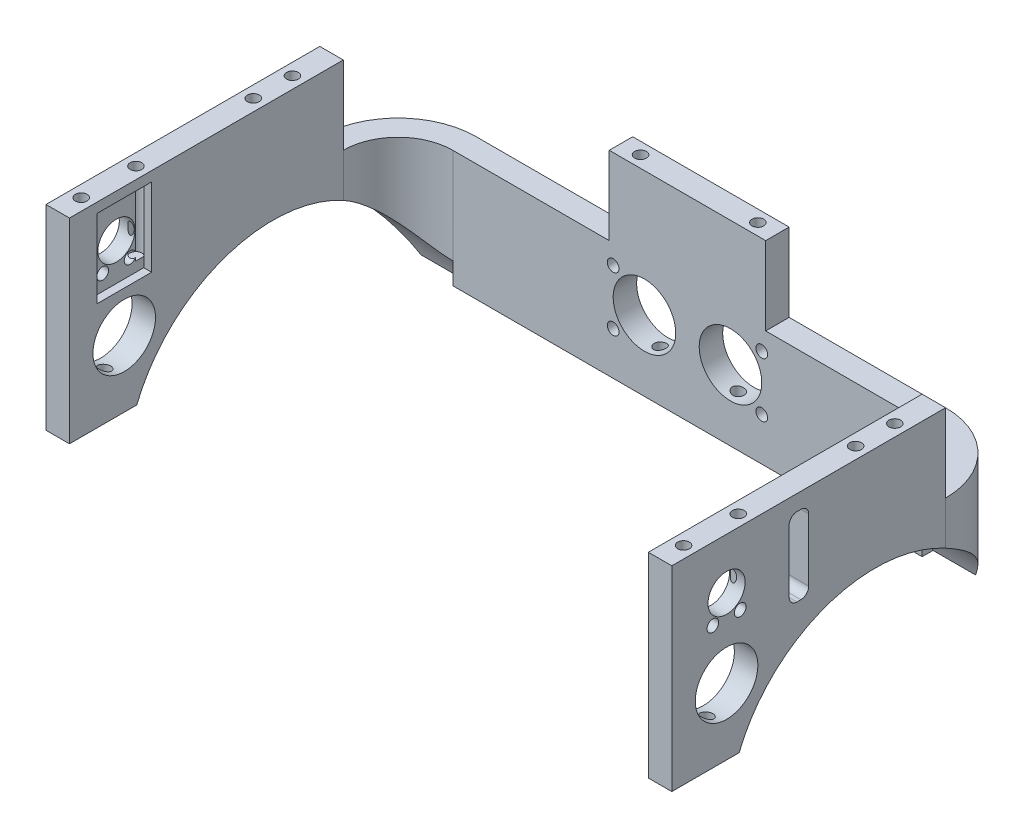
from build123d import *

# Parameters (mm, degrees)
SALIENTE_EXTRUIR1_DEPTH = 50
CROQUIS3_W              = 60
CROQUIS3_H              = 20
CORTAR_EXTRUIR1_DEPTH   = 20
CROQUIS4_R              = 8
CROQUIS4_R_2            = 1.5
CORTAR_EXTRUIR2_DEPTH   = 10
CROQUIS5_R              = 8
CROQUIS5_R_2            = 4.75
CROQUIS5_R_3            = 1.5
CORTAR_EXTRUIR3_DEPTH   = 172
CROQUIS6_W              = 14
CROQUIS6_H              = 20
CROQUIS6_R              = 4.75
CORTAR_EXTRUIR4_DEPTH   = 2
CORTAR_EXTRUIR5_START   = -2
CROQUIS7_W              = 14
CROQUIS7_H              = 20
CROQUIS7_R              = 4.75
CORTAR_EXTRUIR5_DEPTH   = 2
CROQUIS8_R              = 37.5
CORTAR_EXTRUIR6_DEPTH   = 20
CORTAR_EXTRUIR7_START   = -20
CROQUIS9_R              = 37.5
CORTAR_EXTRUIR7_DEPTH   = 20
CROQUIS10_R             = 1.5
CORTAR_EXTRUIR8_DEPTH   = 20
CROQUIS11_R             = 1.5
CORTAR_EXTRUIR9_DEPTH   = 20
CORTAR_EXTRUIR10_DEPTH  = 10


with BuildPart() as part:
    # Croquis1 → Saliente-Extruir1 (new body)
    with BuildSketch(Plane(origin=(0, 0, 0), x_dir=(1, 0, 0), z_dir=(0, 1, 0))):
        with BuildLine():
            Line((-20, -6), (-140, -6))
            ThreePointArc((-140, -6), (-149.899494937, -10.100505063), (-154, -20))
            Line((-154, -20), (-154, -84))
            Line((-154, -84), (-154, -90))
            Line((-154, -90), (-160, -90))
            Line((-160, -90), (-160, -20))
            ThreePointArc((-160, -20), (-154.142135624, -5.857864376), (-140, 0))
            Line((-140, 0), (-20, 0))
            ThreePointArc((-20, 0), (-5.857864376, -5.857864376), (0, -20))
            Line((0, -20), (0, -90))
            Line((0, -90), (-6, -90))
            Line((-6, -90), (-6, -84))
            Line((-6, -84), (-6, -20))
            ThreePointArc((-6, -20), (-10.100505063, -10.100505063), (-20, -6))
        make_face()
    extrude(amount=SALIENTE_EXTRUIR1_DEPTH)

    # Croquis3 → Cortar-Extruir1 (cut)
    with BuildSketch(Plane(origin=(0, 50, 0), x_dir=(1, 0, 0), z_dir=(0, 1, 0))):
        with Locations((-130, -10)):
            Rectangle(CROQUIS3_W, CROQUIS3_H)
        with Locations((-30, -10)):
            Rectangle(CROQUIS3_W, CROQUIS3_H)
    extrude(amount=-CORTAR_EXTRUIR1_DEPTH, mode=Mode.SUBTRACT)

    # Croquis4 → Cortar-Extruir2 (cut)
    with BuildSketch(Plane(origin=(0, 0, 0), x_dir=(-1, 0, 0), z_dir=(0, 0, -1))):
        with Locations((69, 18)):
            Circle(CROQUIS4_R)
        with Locations((91, 18)):
            Circle(CROQUIS4_R)
        with Locations((61, 25)):
            Circle(CROQUIS4_R_2)
        with Locations((99, 25)):
            Circle(CROQUIS4_R_2)
        with Locations((99, 11)):
            Circle(CROQUIS4_R_2)
        with Locations((61, 11)):
            Circle(CROQUIS4_R_2)
    extrude(amount=-CORTAR_EXTRUIR2_DEPTH, mode=Mode.SUBTRACT)

    # Croquis5 → Cortar-Extruir3 (cut)
    with BuildSketch(Plane(origin=(0, 0, 0), x_dir=(0, 0, -1), z_dir=(1, 0, 0))):
        with Locations((-76, 17)):
            Circle(CROQUIS5_R)
        with Locations((-76, 37)):
            Circle(CROQUIS5_R_2)
        with Locations((-72.5, 31.5)):
            Circle(CROQUIS5_R_3)
        with Locations((-79.5, 31.5)):
            Circle(CROQUIS5_R_3)
    extrude(amount=-CORTAR_EXTRUIR3_DEPTH, mode=Mode.SUBTRACT)

    # Croquis6 → Cortar-Extruir4 (cut)
    with BuildSketch(Plane(origin=(-154, 0, 0), x_dir=(0, 0, -1), z_dir=(1, 0, 0))):
        with Locations((-76, 37.5)):
            Rectangle(CROQUIS6_W, CROQUIS6_H)
        with Locations((-76, 37)):
            Circle(CROQUIS6_R, mode=Mode.SUBTRACT)
    extrude(amount=-CORTAR_EXTRUIR4_DEPTH, mode=Mode.SUBTRACT)

    # Croquis7 → Cortar-Extruir5 (cut)
    with BuildSketch(Plane.ZY.offset(6).offset(CORTAR_EXTRUIR5_START)):
        with Locations((76, 37.5)):
            Rectangle(CROQUIS7_W, CROQUIS7_H)
        with Locations(Location((76, 37, 0), (0, 0, 180))):
            Circle(CROQUIS7_R, mode=Mode.SUBTRACT)
    extrude(amount=CORTAR_EXTRUIR5_DEPTH, mode=Mode.SUBTRACT)

    # Croquis8 → Cortar-Extruir6 (cut)
    with BuildSketch(Plane.ZY.offset(160)):
        with Locations((38, -14)):
            Circle(CROQUIS8_R)
    extrude(amount=-CORTAR_EXTRUIR6_DEPTH, mode=Mode.SUBTRACT)

    # Croquis9 → Cortar-Extruir7 (cut)
    with BuildSketch(Plane(origin=(0, 0, 0), x_dir=(0, 0, -1), z_dir=(1, 0, 0)).offset(CORTAR_EXTRUIR7_START)):
        with Locations((-38, -14)):
            Circle(CROQUIS9_R)
    extrude(amount=CORTAR_EXTRUIR7_DEPTH, mode=Mode.SUBTRACT)

    # Croquis10 → Cortar-Extruir8 (cut)
    with BuildSketch(Plane(origin=(0, 0, 0), x_dir=(-1, 0, 0), z_dir=(0, -1, 0))):
        with Locations(Location((90, -3, 0), (0, 0, 90))):
            Circle(CROQUIS10_R)
        with Locations(Location((110, -3, 0), (0, 0, 90))):
            Circle(CROQUIS10_R)
        with Locations(Location((130, -3, 0), (0, 0, 90))):
            Circle(CROQUIS10_R)
        with Locations(Location((70, -3, 0), (0, 0, 90))):
            Circle(CROQUIS10_R)
        with Locations(Location((50, -3, 0), (0, 0, 90))):
            Circle(CROQUIS10_R)
        with Locations(Location((30, -3, 0), (0, 0, 90))):
            Circle(CROQUIS10_R)
        with Locations(Location((157, -86, 0), (0, 0, 90))):
            Circle(CROQUIS10_R)
        with Locations(Location((157, -78, 0), (0, 0, 90))):
            Circle(CROQUIS10_R)
        with Locations(Location((3, -86, 0), (0, 0, 90))):
            Circle(CROQUIS10_R)
        with Locations(Location((3, -78, 0), (0, 0, 90))):
            Circle(CROQUIS10_R)
    extrude(amount=-CORTAR_EXTRUIR8_DEPTH, mode=Mode.SUBTRACT)

    # Croquis11 → Cortar-Extruir9 (cut)
    with BuildSketch(Plane(origin=(0, 50, 0), x_dir=(1, 0, 0), z_dir=(0, 1, 0))):
        with Locations(Location((-157, -84, 0), (0, 0, 270))):
            Circle(CROQUIS11_R)
        with Locations(Location((-157, -70, 0), (0, 0, 270))):
            Circle(CROQUIS11_R)
        with Locations(Location((-157, -40, 0), (0, 0, 270))):
            Circle(CROQUIS11_R)
        with Locations(Location((-157, -30, 0), (0, 0, 270))):
            Circle(CROQUIS11_R)
        with Locations(Location((-3, -30, 0), (0, 0, 270))):
            Circle(CROQUIS11_R)
        with Locations(Location((-3, -40, 0), (0, 0, 270))):
            Circle(CROQUIS11_R)
        with Locations(Location((-3, -70, 0), (0, 0, 270))):
            Circle(CROQUIS11_R)
        with Locations(Location((-3, -84, 0), (0, 0, 270))):
            Circle(CROQUIS11_R)
        with Locations(Location((-95, -3, 0), (0, 0, 270))):
            Circle(CROQUIS11_R)
        with Locations(Location((-65, -3, 0), (0, 0, 270))):
            Circle(CROQUIS11_R)
    extrude(amount=-CORTAR_EXTRUIR9_DEPTH, mode=Mode.SUBTRACT)

    # Croquis12 → Cortar-Extruir10 (cut)
    with BuildSketch(Plane(origin=(0, 0, 0), x_dir=(0, 0, -1), z_dir=(1, 0, 0))):
        with BuildLine():
            Line((-58, 46), (-57, 46))
            ThreePointArc((-57, 46), (-55.585786438, 45.414213562), (-55, 44))
            Line((-55, 44), (-55, 28))
            ThreePointArc((-55, 28), (-55.585786438, 26.585786438), (-57, 26))
            Line((-57, 26), (-58, 26))
            ThreePointArc((-58, 26), (-59.414213562, 26.585786438), (-60, 28))
            Line((-60, 28), (-60, 44))
            ThreePointArc((-60, 44), (-59.414213562, 45.414213562), (-58, 46))
        make_face()
    extrude(amount=-CORTAR_EXTRUIR10_DEPTH, mode=Mode.SUBTRACT)


solid = part.part
